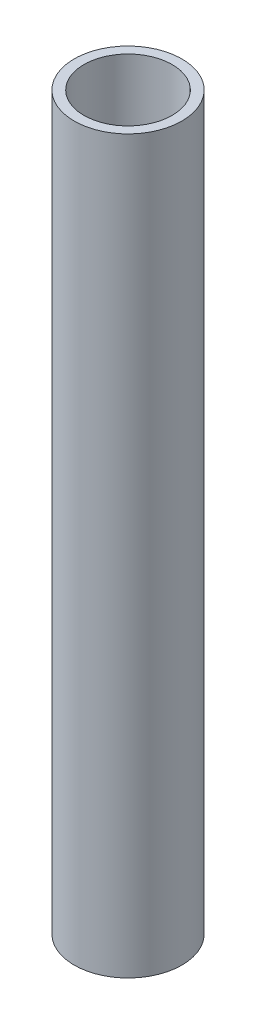
from build123d import *

# Parameters (mm, degrees)
SKETCH1_R           = 0.7366
SKETCH1_R_2         = 0.60325
BOSS_EXTRUDE1_DEPTH = 10


with BuildPart() as part:
    # Sketch1 → Boss-Extrude1 (new body)
    with BuildSketch(Plane.XZ.offset(-37.452667034)):
        with Locations((0.7, -1.6)):
            Circle(SKETCH1_R)
        with Locations((0.7, -1.6)):
            Circle(SKETCH1_R_2, mode=Mode.SUBTRACT)
    extrude(amount=BOSS_EXTRUDE1_DEPTH)


solid = part.part
